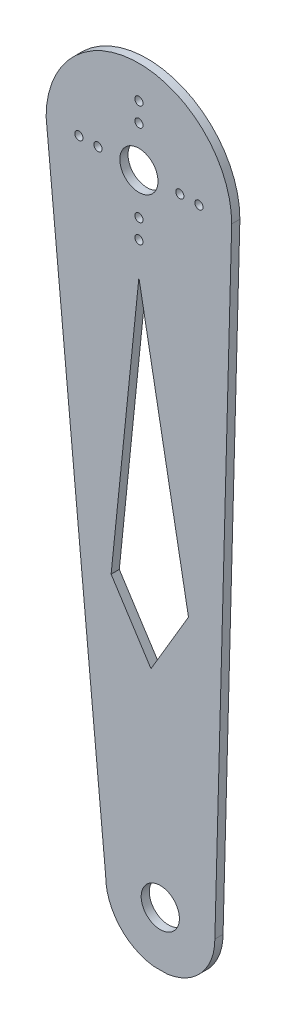
from build123d import *

# Parameters (mm, degrees)
EXTRUDE_1_DEPTH     = 3
CUT_EXTRUDE_1_DEPTH = 3
CUT_EXTRUDE_2_DEPTH = 3
SKETCH_5_R          = 1.5
CUT_EXTRUDE_3_DEPTH = 3
CUT_EXTRUDE_4_DEPTH = 3
SKETCH_7_R          = 7
CUT_EXTRUDE_5_DEPTH = 3
SKETCH_8_R          = 7
CUT_EXTRUDE_6_DEPTH = 10


with BuildPart() as part:
    # 草图1 → 凸台-拉伸1 (new body)
    with BuildSketch(Plane.XY):
        with BuildLine():
            Line((34, 0), (42.481679801, -249.85608079))
            Line((42.481679801, -249.85608079), (-25.518320199, -249.85608079))
            Line((-25.518320199, -249.85608079), (-34, 0))
            ThreePointArc((-34, 0), (0, 34), (34, 0))
        make_face()
    extrude(amount=EXTRUDE_1_DEPTH)

    # 草图3 → 切除-拉伸1 (cut)
    with BuildSketch(Plane.XY.offset(3)):
        with BuildLine():
            Line((-12.172192567, -230.017175725), (-34, 0))
            Line((-34, 0), (-25.518320199, -249.85608079))
            Line((-25.518320199, -249.85608079), (5.294460669, -249.85608079))
            ThreePointArc((5.294460669, -249.85608079), (-7.18330404, -243.233322379), (-12.172192567, -230.017175725))
        make_face()
    extrude(amount=-CUT_EXTRUDE_1_DEPTH, mode=Mode.SUBTRACT)

    # 草图3<4> → 切除-拉伸2 (cut)
    with BuildSketch(Plane.XY.offset(3)):
        with BuildLine():
            Line((42.481679801, -249.85608079), (34, 0))
            Line((34, 0), (27.827807433, -230.017175725))
            ThreePointArc((27.827807433, -230.017175725), (22.838918905, -243.233322379), (10.361154196, -249.85608079))
            Line((10.361154196, -249.85608079), (42.481679801, -249.85608079))
        make_face()
    extrude(amount=-CUT_EXTRUDE_2_DEPTH, mode=Mode.SUBTRACT)

    # 草图5 → 切除-拉伸3 (cut)
    with BuildSketch(Plane.XY.offset(3)):
        with Locations((0, 22)):
            Circle(SKETCH_5_R)
        with Locations((0, 15)):
            Circle(SKETCH_5_R)
        with Locations((-22, 0)):
            Circle(SKETCH_5_R)
        with Locations((-15, 0)):
            Circle(SKETCH_5_R)
        with Locations((0, -15)):
            Circle(SKETCH_5_R)
        with Locations((15, 0)):
            Circle(SKETCH_5_R)
        with Locations((22, 0)):
            Circle(SKETCH_5_R)
        with Locations((0, -22)):
            Circle(SKETCH_5_R)
    extrude(amount=-CUT_EXTRUDE_3_DEPTH, mode=Mode.SUBTRACT)

    # 草图6 → 切除-拉伸4 (cut)
    with BuildSketch(Plane.XY.offset(3)):
        Polygon((0, -34), (-10.183472327, -133.231632376), (4.42204079, -155.940198746), (18.166966985, -132.700641867), align=None)
    extrude(amount=-CUT_EXTRUDE_4_DEPTH, mode=Mode.SUBTRACT)

    # 草图7 → 切除-拉伸5 (cut)
    with BuildSketch(Plane.XY.offset(3)):
        with Locations((7.827807433, -230.017175725)):
            Circle(SKETCH_7_R)
    extrude(amount=-CUT_EXTRUDE_5_DEPTH, mode=Mode.SUBTRACT)

    # 草图8 → 切除-拉伸6 (cut)
    with BuildSketch(Plane.XY.offset(3)):
        Circle(SKETCH_8_R)
    extrude(amount=-CUT_EXTRUDE_6_DEPTH, mode=Mode.SUBTRACT)


solid = part.part
